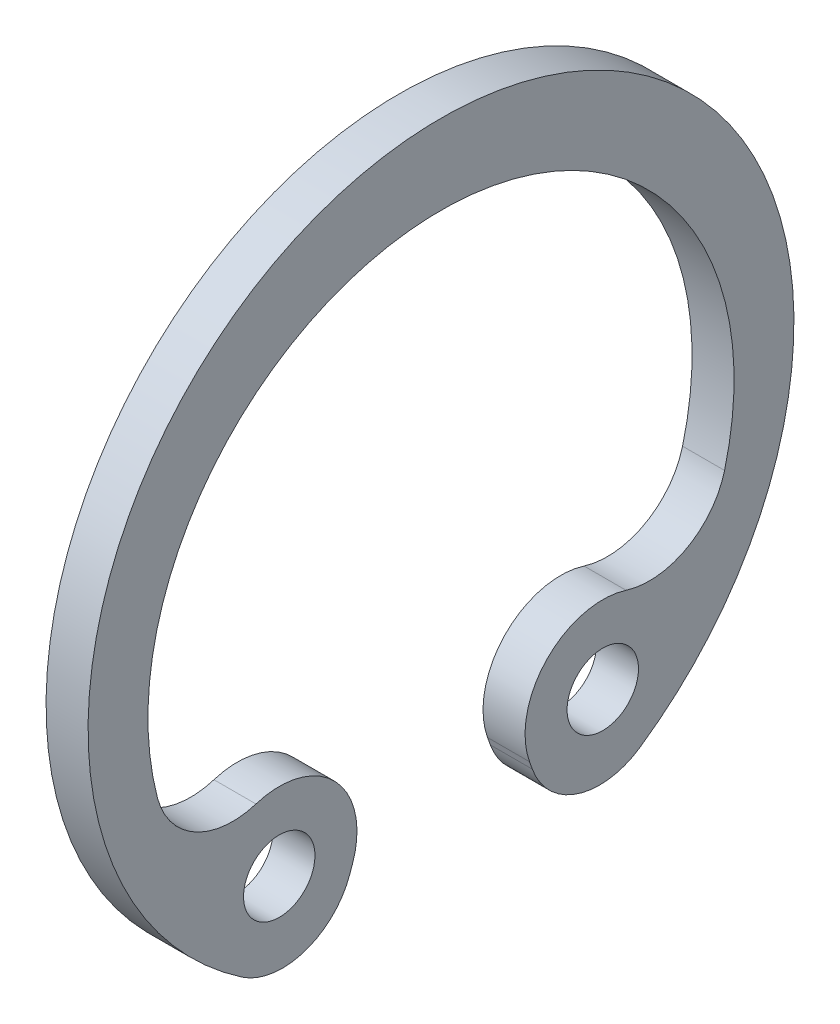
from build123d import *

# Parameters (mm, degrees)
BOSS_EXTRUDE1_DEPTH      = 0.5
BOSS_EXTRUDE1_DEPTH_BACK = 0.5
SKETCH1_R                = 0.85


with BuildPart() as part:
    # Sketch1 → Boss-Extrude1 (new, two sides: drawn at the far end of the back side and taken through both)
    with BuildSketch(Plane(origin=(0, 0, 0), x_dir=(0, 0, -1), z_dir=(1, 0, 0)).offset(-BOSS_EXTRUDE1_DEPTH_BACK)):
        with BuildLine():
            Line((-2.173337586, -6.105456882), (-2.107128968, -5.919460069))
            ThreePointArc((-2.107128968, -5.919460069), (-2.517494945, -4.015728705), (-4.40445692, -3.534098298))
            ThreePointArc((-4.40445692, -3.534098298), (-5.854874371, -3.387705714), (-6.748960786, -2.23629308))
            ThreePointArc((-6.748960786, -2.23629308), (0, 6.5), (6.748960786, -2.23629308))
            ThreePointArc((6.748960786, -2.23629308), (5.854874409, -3.387705693), (4.404457002, -3.534098324))
            ThreePointArc((4.404457002, -3.534098324), (2.517494975, -4.015728674), (2.107128968, -5.919460069))
            Line((2.107128968, -5.919460069), (2.173337586, -6.105456882))
            ThreePointArc((2.173337586, -6.105456882), (3.247964263, -7.151631133), (4.732703867, -6.939849718))
            ThreePointArc((4.732703867, -6.939849718), (0, 8.4), (-4.732703867, -6.939849718))
            ThreePointArc((-4.732703867, -6.939849718), (-3.247964263, -7.151631133), (-2.173337586, -6.105456882))
        make_face()
        with Locations((3.85, -5.29905652)):
            Circle(SKETCH1_R, mode=Mode.SUBTRACT)
        with Locations((-3.85, -5.29905652)):
            Circle(SKETCH1_R, mode=Mode.SUBTRACT)
    extrude(amount=BOSS_EXTRUDE1_DEPTH + BOSS_EXTRUDE1_DEPTH_BACK)


solid = part.part
